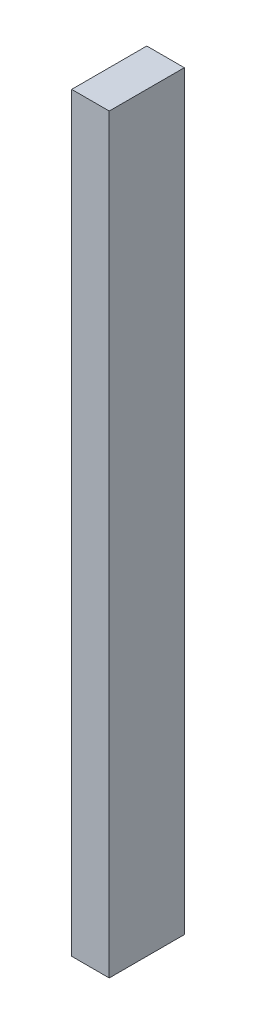
from build123d import *

# Parameters (mm, degrees)
SKETCH_1_W          = 25
SKETCH_1_H          = 50
EXTRUDE_1_DEPTH     = 550
SKETCH_2_R          = 4
CUT_EXTRUDE_1_DEPTH = 10
CUT_EXTRUDE_START   = -10
SKETCH_3_R          = 4
CUT_EXTRUDE_2_DEPTH = 10
SKETCH_4_W          = 25
SKETCH_4_H          = 50
CUT_EXTRUDE_3_DEPTH = 50


with BuildPart() as part:
    # Эскиз1 → Бобышка-Вытянуть1 (new body)
    with BuildSketch(Plane(origin=(0, 0, 0), x_dir=(1, 0, 0), z_dir=(0, 1, 0))):
        Rectangle(SKETCH_1_W, SKETCH_1_H)
    extrude(amount=EXTRUDE_1_DEPTH)

    # Эскиз2 → Вырез-Вытянуть1 (cut)
    with BuildSketch(Plane(origin=(0, 550, 0), x_dir=(1, 0, 0), z_dir=(0, 1, 0))):
        with Locations(Location((0, 0, 0), (0, 0, 270))):
            Circle(SKETCH_2_R)
    extrude(amount=-CUT_EXTRUDE_1_DEPTH, mode=Mode.SUBTRACT)

    # Эскиз3 → Вырез-Вытянуть2 (cut)
    with BuildSketch(Plane.XZ.offset(CUT_EXTRUDE_START)):
        with Locations(Location((0, 0, 0), (0, 0, 90))):
            Circle(SKETCH_3_R)
    extrude(amount=CUT_EXTRUDE_2_DEPTH, mode=Mode.SUBTRACT)

    # Эскиз4 → Вырез-Вытянуть3 (cut)
    with BuildSketch(Plane(origin=(0, 550, 0), x_dir=(1, 0, 0), z_dir=(0, 1, 0))):
        Rectangle(SKETCH_4_W, SKETCH_4_H)
    extrude(amount=-CUT_EXTRUDE_3_DEPTH, mode=Mode.SUBTRACT)


solid = part.part
